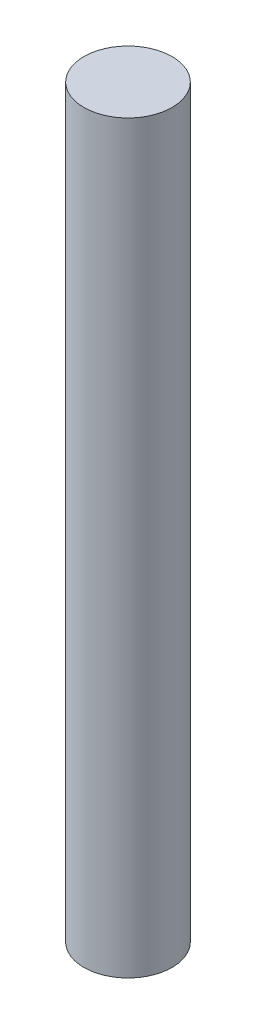
from build123d import *

# Parameters (mm, degrees)
SKETCH1_R           = 14.8
BOSS_EXTRUDE1_DEPTH = 250


with BuildPart() as part:
    # Sketch1 → Boss-Extrude1 (new body)
    with BuildSketch(Plane(origin=(0, 0, 0), x_dir=(1, 0, 0), z_dir=(0, 1, 0))):
        with Locations(Location((0, 0, 0), (0, 0, 270))):
            Circle(SKETCH1_R)
    extrude(amount=BOSS_EXTRUDE1_DEPTH)


solid = part.part
